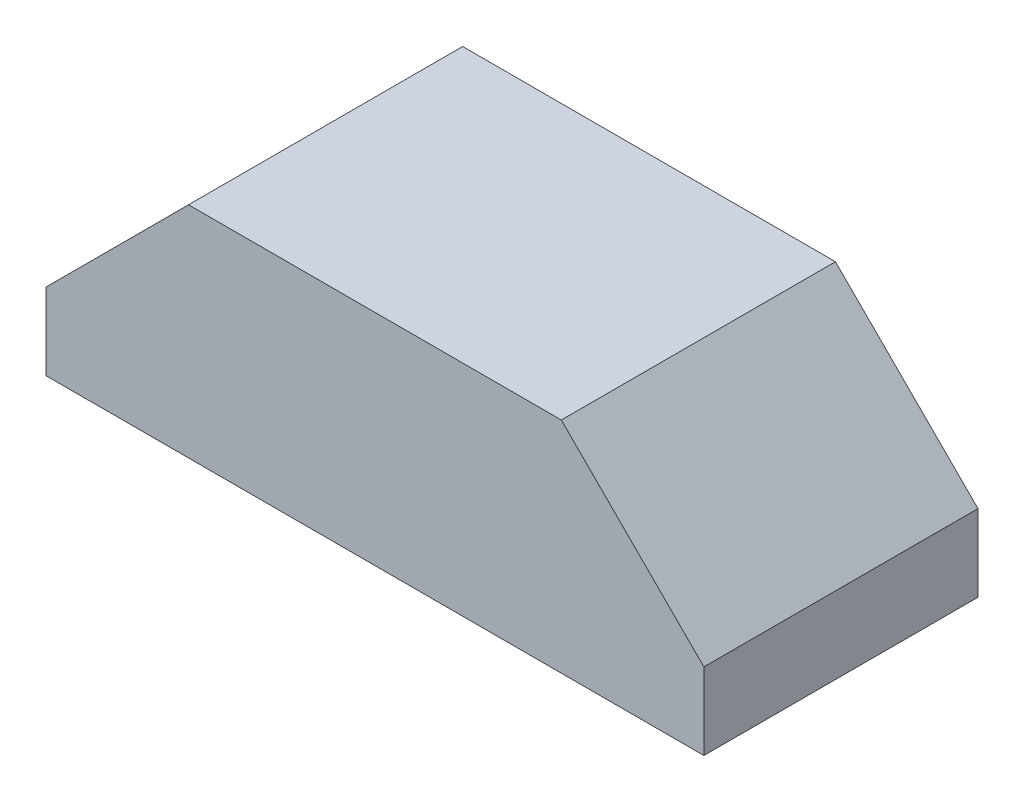
from build123d import *

# Parameters (mm, degrees)
AUFSATZ_LINEAR_AUSTRAGEN1_DEPTH = 5


with BuildPart() as part:
    # Skizze1 → Aufsatz-Linear austragen1 (new body)
    with BuildSketch(Plane.XY):
        Polygon((3.4, 1.808858787), (-3.4, 1.808858787), (-6, -0.791141213), (-6, -2.191141213), (6, -2.191141213), (6, -0.791141213), align=None)
    extrude(amount=AUFSATZ_LINEAR_AUSTRAGEN1_DEPTH)


solid = part.part
